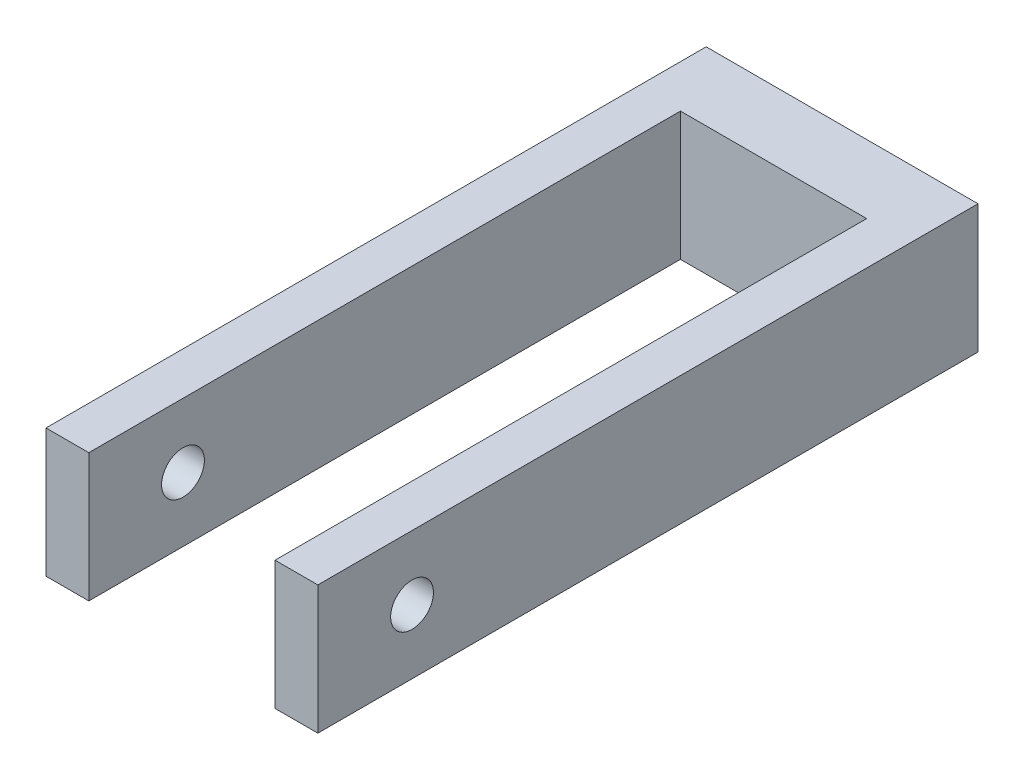
from build123d import *

# Parameters (mm, degrees)
SKETCH1_W           = 31.75
SKETCH1_H           = 15
BOSS_EXTRUDE1_DEPTH = 8
SKETCH2_W           = 5
SKETCH2_H           = 15
BOSS_EXTRUDE2_DEPTH = 69.1
SKETCH3_R           = 2.5
CUT_EXTRUDE1_DEPTH  = 69.1
SKETCH4_R           = 4
SKETCH4_R_2         = 2
CUT_EXTRUDE3_DEPTH  = 4
SKETCH5_R           = 1.5
CUT_EXTRUDE4_DEPTH  = 3


with BuildPart() as part:
    # Sketch1 → Boss-Extrude1 (new body)
    with BuildSketch(Plane.XY):
        with Locations((-0.926352113, 0.669031185)):
            Rectangle(SKETCH1_W, SKETCH1_H)
    extrude(amount=BOSS_EXTRUDE1_DEPTH)

    # Sketch2 → Boss-Extrude2 (add)
    with BuildSketch(Plane.XY.offset(8)):
        with Locations((-14.301352113, 0.669031185)):
            Rectangle(SKETCH2_W, SKETCH2_H)
        with Locations((12.448647887, 0.669031185)):
            Rectangle(SKETCH2_W, SKETCH2_H)
    extrude(amount=BOSS_EXTRUDE2_DEPTH)

    # Sketch3 → Cut-Extrude1 (cut)
    with BuildSketch(Plane(origin=(14.948647887, 0, 0), x_dir=(0, 0, -1), z_dir=(1, 0, 0))):
        with Locations(Location((-66.1, 0.669031185, 0), (0, 0, 90))):
            Circle(SKETCH3_R)
    extrude(amount=-CUT_EXTRUDE1_DEPTH, mode=Mode.SUBTRACT)

    # Sketch4 → Cut-Extrude3 (cut)
    with BuildSketch(Plane(origin=(0, 0, 0), x_dir=(-1, 0, 0), z_dir=(0, 0, -1))):
        with Locations((0.926352113, 0.669031185)):
            Circle(SKETCH4_R)
        with Locations((0.926352113, 0.669031185)):
            Circle(SKETCH4_R_2, mode=Mode.SUBTRACT)
    extrude(amount=-CUT_EXTRUDE3_DEPTH, mode=Mode.SUBTRACT)

    # Sketch5 → Cut-Extrude4 (cut)
    with BuildSketch(Plane.XZ.offset(6.830968815)):
        with Locations((-0.926352113, 4)):
            Circle(SKETCH5_R)
    extrude(amount=-CUT_EXTRUDE4_DEPTH, mode=Mode.SUBTRACT)


solid = part.part
